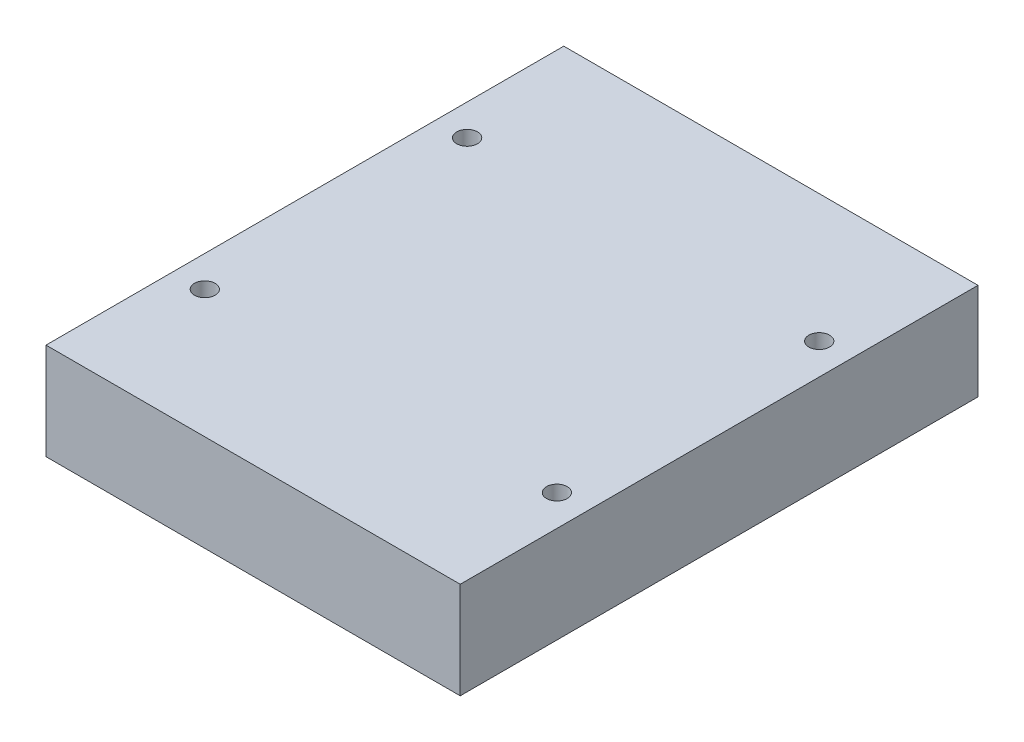
from build123d import *

# Parameters (mm, degrees)
SKETCH1_W           = 60
SKETCH1_H           = 75
BOSS_EXTRUDE1_DEPTH = 14
SKETCH2_R           = 1.5
CUT_EXTRUDE1_DEPTH  = 14


with BuildPart() as part:
    # Sketch1 → Boss-Extrude1 (new body)
    with BuildSketch(Plane(origin=(0, 0, 0), x_dir=(1, 0, 0), z_dir=(0, 1, 0))):
        Rectangle(SKETCH1_W, SKETCH1_H)
    extrude(amount=BOSS_EXTRUDE1_DEPTH)

    # Sketch2 → Cut-Extrude1 (cut)
    with BuildSketch(Plane(origin=(0, 14, 0), x_dir=(1, 0, 0), z_dir=(0, 1, 0))):
        with Locations(Location((-25.5, 19, 0), (0, 0, 270))):
            Circle(SKETCH2_R)
        with Locations(Location((25.5, 19, 0), (0, 0, 270))):
            Circle(SKETCH2_R)
        with Locations(Location((25.5, -19, 0), (0, 0, 270))):
            Circle(SKETCH2_R)
        with Locations(Location((-25.5, -19, 0), (0, 0, 270))):
            Circle(SKETCH2_R)
    extrude(amount=-CUT_EXTRUDE1_DEPTH, mode=Mode.SUBTRACT)


solid = part.part
